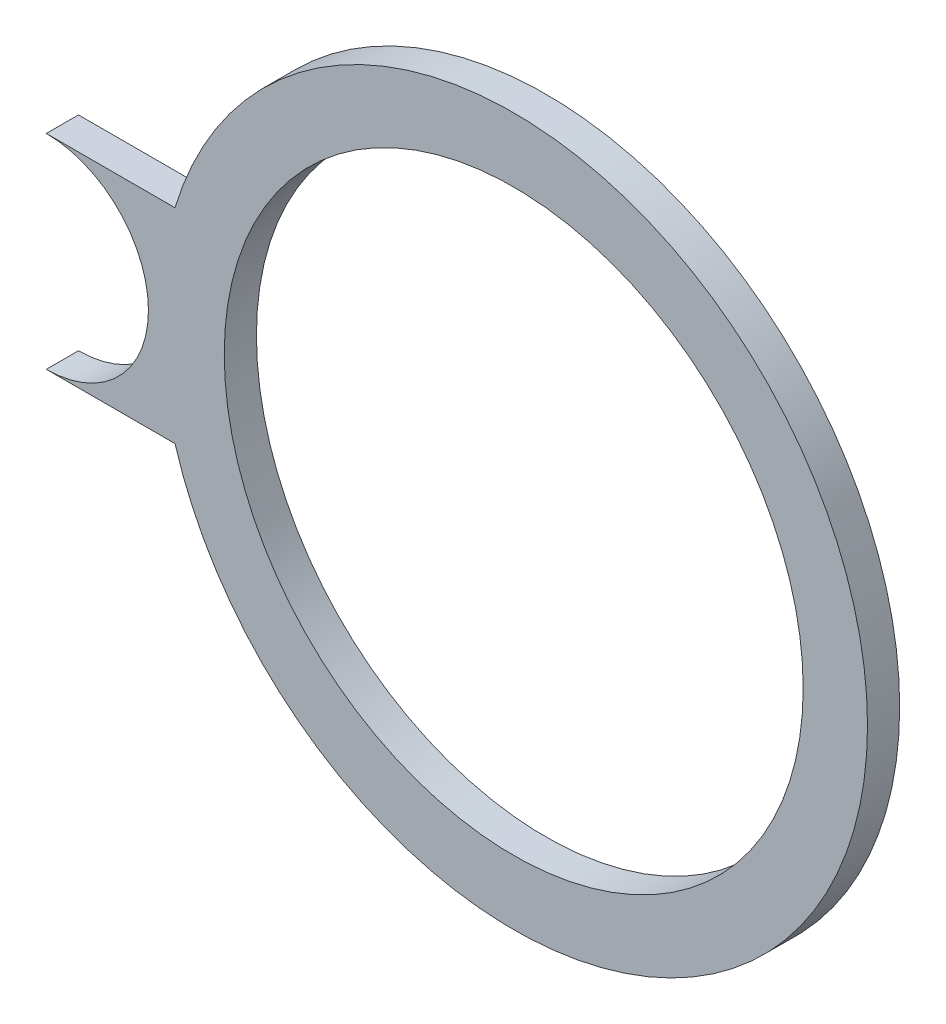
from build123d import *

# Parameters (mm, degrees)
SKETCH3_R           = 45
BOSS_EXTRUDE1_DEPTH = 5


with BuildPart() as part:
    # Sketch3 → Boss-Extrude1 (new body)
    with BuildSketch(Plane(origin=(0, 0, 0), x_dir=(0, 1, 0), z_dir=(0, 0, 1))):
        with BuildLine():
            Line((-15.875, 72.659133823), (-15.875, 52.659133823))
            ThreePointArc((-15.875, 52.659133823), (0, -55), (15.875, 52.659133823))
            Line((15.875, 52.659133823), (15.875, 72.659133823))
            ThreePointArc((15.875, 72.659133823), (0, 56.784133823), (-15.875, 72.659133823))
        make_face()
        with Locations(Location((0, 0, 0), (0, 0, 270))):
            Circle(SKETCH3_R, mode=Mode.SUBTRACT)
    extrude(amount=BOSS_EXTRUDE1_DEPTH)


solid = part.part
